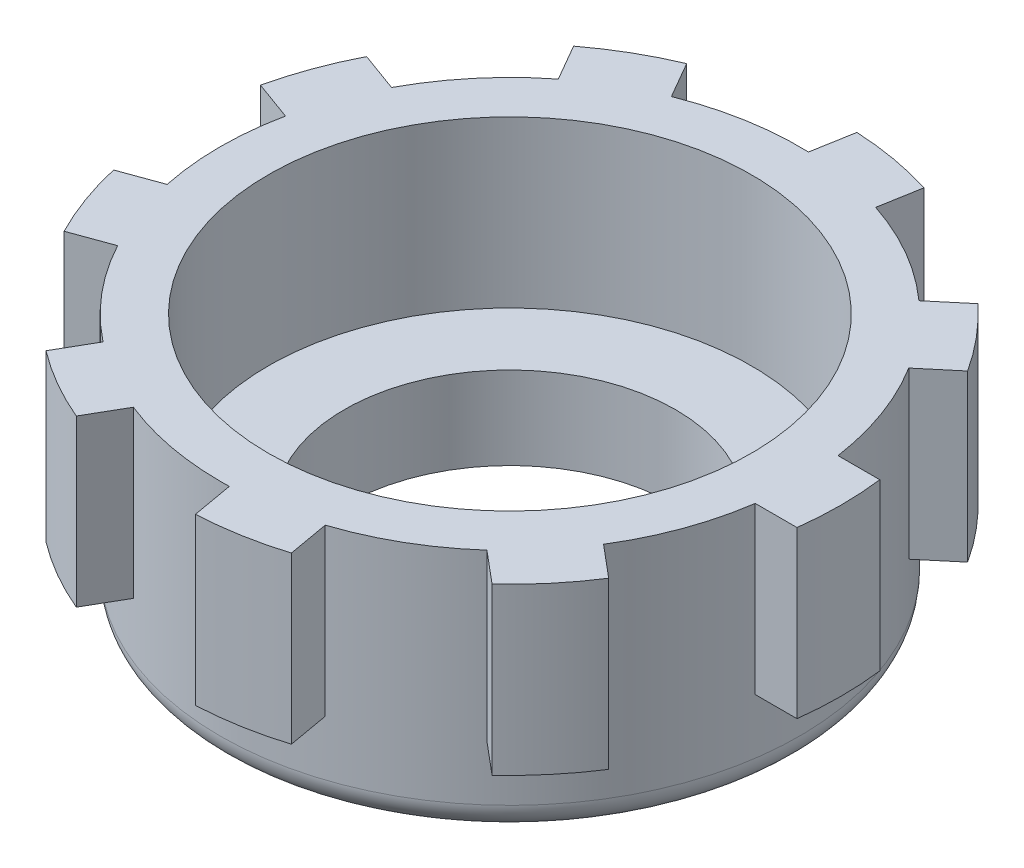
from build123d import *
from build123d.topology import SkipClean

# Parameters (mm, degrees)
SKETCH1_R           = 24
BOSS_EXTRUDE1_DEPTH = 18
HOLE2_D             = 24
HOLE2_DEPTH         = 18
HOLE2_CBORE_D       = 35
HOLE2_CBORE_DEPTH   = 12
HOLE2_TIP           = 7.210327428
CUT_EXTRUDE1_START  = -12
CUT_EXTRUDE1_DEPTH  = 12
SKETCH7_R           = 24
SKETCH7_R_2         = 21
CUT_EXTRUDE2_DEPTH  = 6
FILLET1_R           = 2


with BuildPart() as part:
    # Sketch1 → Boss-Extrude1 (new body)
    with BuildSketch(Plane(origin=(0, 0, 0), x_dir=(1, 0, 0), z_dir=(0, 1, 0))):
        with Locations(Location((0, 0, 0), (0, 0, 270))):
            Circle(SKETCH1_R)
    extrude(amount=BOSS_EXTRUDE1_DEPTH)

    # Hole2
    with Locations(Plane(origin=(0, 18, 0), x_dir=(1, 0, 0), z_dir=(0, 1, 0))):
        with Locations((0, 0)):
            CounterBoreHole(HOLE2_D / 2, HOLE2_CBORE_D / 2, HOLE2_CBORE_DEPTH, depth=HOLE2_DEPTH)
            with Locations((0, 0, -(HOLE2_DEPTH + HOLE2_TIP / 2))):  # 118° drill point
                Cone(0, HOLE2_D / 2, HOLE2_TIP, mode=Mode.SUBTRACT)

    # Sketch6 → Cut-Extrude1 (cut)
    with BuildSketch(Plane(origin=(0, 18, 0), x_dir=(1, 0, 0), z_dir=(0, 1, 0)).offset(CUT_EXTRUDE1_START)):
        with BuildLine():
            Line((20.784609691, 3), (23.8117618, 3))
            ThreePointArc((23.8117618, 3), (22.552622899, 8.20848344), (20.169230637, 13.00777212))
            Line((20.169230637, 13.00777212), (17.850297585, 11.061956252))
            ThreePointArc((17.850297585, 11.061956252), (19.733545037, 7.18242301), (20.784609691, 3))
        make_face()
        with BuildLine():
            Line((20.784609691, -3), (23.8117618, -3))
            ThreePointArc((23.8117618, -3), (22.552622899, -8.20848344), (20.169230637, -13.00777212))
            Line((20.169230637, -13.00777212), (17.850297585, -11.061956252))
            ThreePointArc((17.850297585, -11.061956252), (19.733545037, -7.18242301), (20.784609691, -3))
        make_face()
        with BuildLine():
            Line((13.993571927, -15.658222911), (16.312504978, -17.604038779))
            ThreePointArc((16.312504978, -17.604038779), (12, -20.784609691), (7.089292303, -22.9290631))
            Line((7.089292303, -22.9290631), (6.563632855, -19.947900234))
            ThreePointArc((6.563632855, -19.947900234), (10.5, -18.186533479), (13.993571927, -15.658222911))
        make_face()
        with BuildLine():
            Line((0.654786337, -20.9897893), (1.180445784, -23.970952166))
            ThreePointArc((1.180445784, -23.970952166), (-4.167556264, -23.635386072), (-9.307804688, -22.121590627))
            Line((-9.307804688, -22.121590627), (-7.794228634, -19.5))
            ThreePointArc((-7.794228634, -19.5), (-3.646611731, -20.680962813), (0.654786337, -20.9897893))
        make_face()
        with BuildLine():
            Line((-12.990381057, -16.5), (-14.503957111, -19.121590627))
            ThreePointArc((-14.503957111, -19.121590627), (-18.385066635, -15.426902632), (-21.349676421, -10.963180046))
            Line((-21.349676421, -10.963180046), (-18.505083922, -9.927833048))
            ThreePointArc((-18.505083922, -9.927833048), (-16.086933305, -13.498539803), (-12.990381057, -16.5))
        make_face()
        with BuildLine():
            Line((-20.557204782, -4.289677323), (-23.401797281, -5.325024321))
            ThreePointArc((-23.401797281, -5.325024321), (-24, 0), (-23.401797281, 5.325024321))
            Line((-23.401797281, 5.325024321), (-20.557204782, 4.289677323))
            ThreePointArc((-20.557204782, 4.289677323), (-21, 0), (-20.557204782, -4.289677323))
        make_face()
        with BuildLine():
            Line((-18.505083922, 9.927833048), (-21.349676421, 10.963180046))
            ThreePointArc((-21.349676421, 10.963180046), (-18.385066635, 15.426902632), (-14.503957111, 19.121590627))
            Line((-14.503957111, 19.121590627), (-12.990381057, 16.5))
            ThreePointArc((-12.990381057, 16.5), (-16.086933305, 13.498539803), (-18.505083922, 9.927833048))
        make_face()
        with BuildLine():
            Line((-7.794228634, 19.5), (-9.307804688, 22.121590627))
            ThreePointArc((-9.307804688, 22.121590627), (-4.167556264, 23.635386072), (1.180445784, 23.970952166))
            Line((1.180445784, 23.970952166), (0.654786337, 20.9897893))
            ThreePointArc((0.654786337, 20.9897893), (-3.646611731, 20.680962813), (-7.794228634, 19.5))
        make_face()
        with BuildLine():
            Line((6.563632855, 19.947900234), (7.089292303, 22.9290631))
            ThreePointArc((7.089292303, 22.9290631), (12, 20.784609691), (16.312504978, 17.604038779))
            Line((16.312504978, 17.604038779), (13.993571927, 15.658222911))
            ThreePointArc((13.993571927, 15.658222911), (10.5, 18.186533479), (6.563632855, 19.947900234))
        make_face()
    extrude(amount=CUT_EXTRUDE1_DEPTH, mode=Mode.SUBTRACT)

    # Sketch7 → Cut-Extrude2 (cut)
    with SkipClean():  # the faces are left unmerged after this step: merging them gives an invalid solid
        with BuildSketch(Plane.XZ):
            Circle(SKETCH7_R)
            with Locations(Location((0, 0, 0), (0, 0, 88.213210702))):
                Circle(SKETCH7_R_2, mode=Mode.SUBTRACT)
        extrude(amount=-CUT_EXTRUDE2_DEPTH, mode=Mode.SUBTRACT)

    # Fillet1
    fillet1_edges = [part.edges().sort_by_distance(p)[0] for p in [
        (-0.654786337, 0, -20.9897893),
    ]]
    fillet(fillet1_edges, radius=FILLET1_R)


solid = part.part
